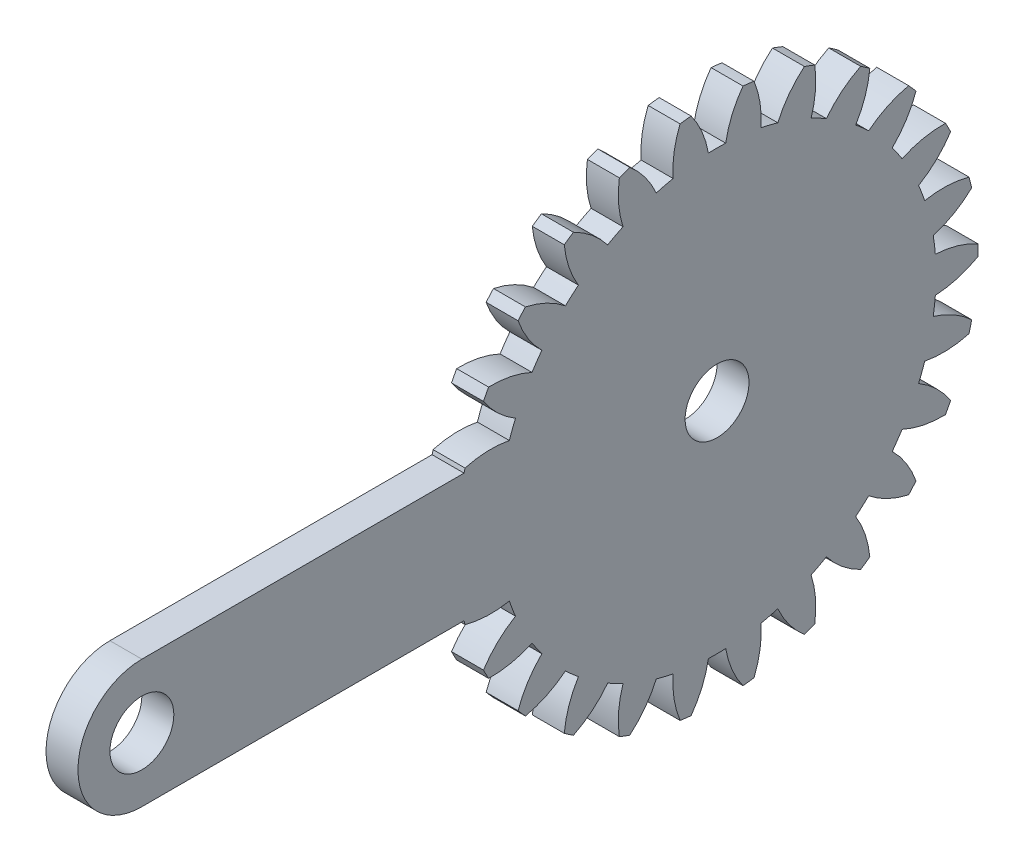
from build123d import *

# Parameters (mm, degrees)
BASPROSKE_W         = 3
BASPROSKE_H         = 24.5
TOOTHCUT_DEPTH      = 35.777866525
TEETHCUTS_COUNT     = 26
TEETHCUTS_ANGLE     = 346.153846154
BORSKE_R            = 3
BORE_DEPTH          = 50.0000508
BOSS_EXTRUDE1_START = 3
SKETCH2_R           = 3
BOSS_EXTRUDE1_DEPTH = 3


with BuildPart() as part:
    # BasProSke → Base-Revolve (revolve)
    with BuildSketch(Plane(origin=(0, 0, 0), x_dir=(1, 0, 0), z_dir=(0, 1, 0)), mode=Mode.PRIVATE) as base_revolve_sk:
        with Locations((1.5, 12.25)):
            Rectangle(BASPROSKE_W, BASPROSKE_H)
    revolve(base_revolve_sk.sketch.rotate(Axis((-10, 0, 0), (1, 0, 0)), 180), axis=Axis((-10, 0, 0), (1, 0, 0)))

    # TooCutSke → ToothCut (cut, through all)
    with BuildSketch(Plane(origin=(0, 0, 0), x_dir=(0, 0, -1), z_dir=(1, 0, 0))):
        with BuildLine():
            ThreePointArc((0.813448928, 20.545402967), (0, 20.5615), (-0.813448928, 20.545402967))
            ThreePointArc((-0.813448928, 20.545402967), (-1.408477569, 22.569593712), (-2.4536582, 24.402352481))
            ThreePointArc((-2.4536582, 24.402352481), (0, 24.5254), (2.4536582, 24.402352481))
            ThreePointArc((2.4536582, 24.402352481), (1.408477569, 22.569593712), (0.813448928, 20.545402967))
        make_face()
    toothcut = extrude(amount=TOOTHCUT_DEPTH, mode=Mode.SUBTRACT)

    # TeethCuts: ToothCut ×26 about axis
    teethcuts_axis = Axis((-10, 0, 0), (1, 0, 0))
    for i in range(1, TEETHCUTS_COUNT):
        add(toothcut.rotate(teethcuts_axis, i * TEETHCUTS_ANGLE / (TEETHCUTS_COUNT - 1)), mode=Mode.SUBTRACT)

    # BorSke → Bore (cut, symmetric)
    with BuildSketch(Plane(origin=(0, 0, 0), x_dir=(0, 0, -1), z_dir=(1, 0, 0))):
        with Locations(Location((0, 0, 0), (0, 0, 180))):
            Circle(BORSKE_R)
    extrude(amount=BORE_DEPTH, both=True, mode=Mode.SUBTRACT)

    # Sketch2 → Boss-Extrude1 (add)
    with BuildSketch(Plane(origin=(0, 0, 0), x_dir=(0, 0, -1), z_dir=(1, 0, 0)).offset(BOSS_EXTRUDE1_START)):
        with BuildLine():
            Line((0, -6), (-54, -6))
            ThreePointArc((-54, -6), (-60, 0), (-54, 6))
            Line((-54, 6), (0, 6))
            ThreePointArc((0, 6), (6, 0), (0, -6))
        make_face()
        with Locations((-54, 0)):
            Circle(SKETCH2_R, mode=Mode.SUBTRACT)
        with Locations(Location((0, 0, 0), (0, 0, 180))):
            Circle(SKETCH2_R, mode=Mode.SUBTRACT)
    extrude(amount=-BOSS_EXTRUDE1_DEPTH)


solid = part.part
